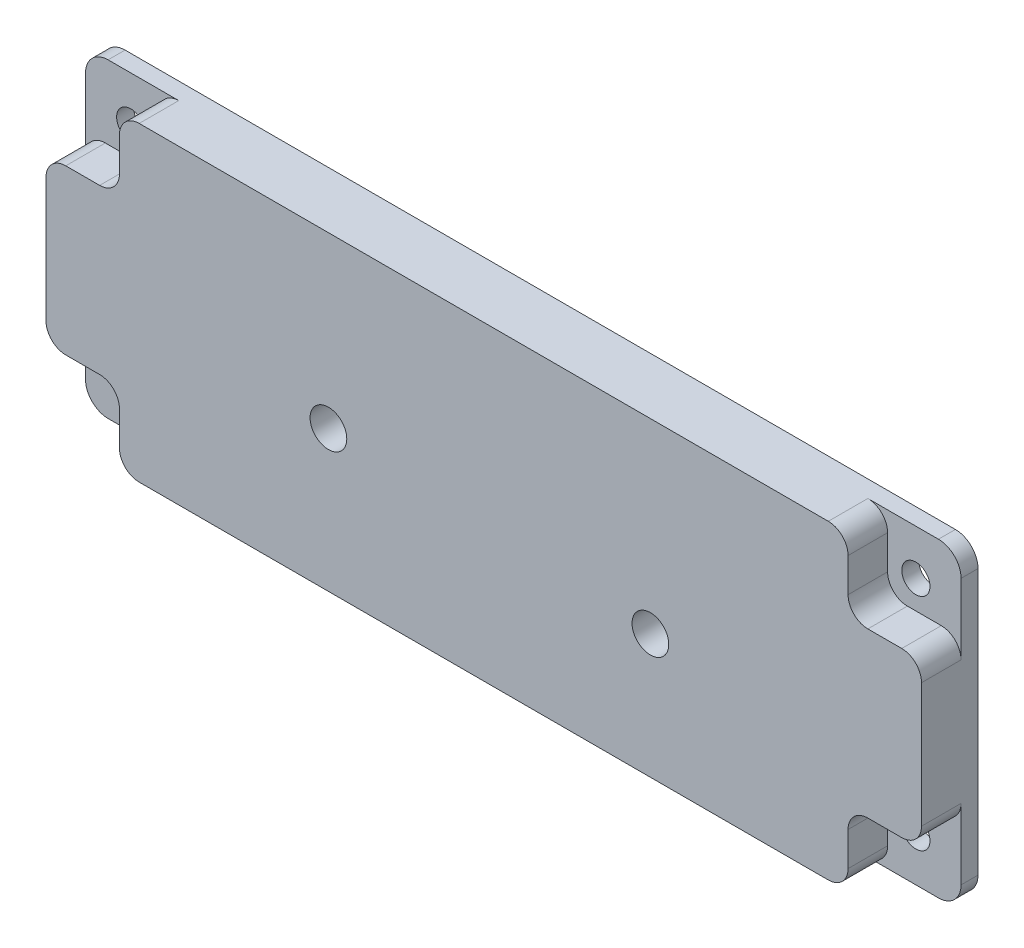
from build123d import *

# Parameters (mm, degrees)
SKETCH1_R           = 3.25
BOSS_EXTRUDE1_DEPTH = 10
CUT_EXTRUDE1_DEPTH  = 7
SKETCH3_R           = 2.5
CUT_EXTRUDE2_DEPTH  = 10
FILLET1_R           = 3.5


with BuildPart() as part:
    # Sketch1 → Boss-Extrude1 (new body)
    with BuildSketch(Plane.XY):
        with BuildLine():
            Line((-73.747603834, 33.92172524), (73.252396166, 33.92172524))
            ThreePointArc((73.252396166, 33.92172524), (76.080823291, 32.750152364), (77.252396166, 29.92172524))
            Line((77.252396166, 29.92172524), (77.252396166, -17.07827476))
            ThreePointArc((77.252396166, -17.07827476), (76.080823291, -19.906701885), (73.252396166, -21.07827476))
            Line((73.252396166, -21.07827476), (-73.747603834, -21.07827476))
            ThreePointArc((-73.747603834, -21.07827476), (-76.576030959, -19.906701885), (-77.747603834, -17.07827476))
            Line((-77.747603834, -17.07827476), (-77.747603834, 29.92172524))
            ThreePointArc((-77.747603834, 29.92172524), (-76.576030959, 32.750152364), (-73.747603834, 33.92172524))
        make_face()
        with Locations((-27.747603834, 3.92172524)):
            Circle(SKETCH1_R, mode=Mode.SUBTRACT)
        with Locations((29.252396166, 0.92172524)):
            Circle(SKETCH1_R, mode=Mode.SUBTRACT)
    extrude(amount=BOSS_EXTRUDE1_DEPTH)

    # Sketch2 → Cut-Extrude1 (cut)
    with BuildSketch(Plane.XY.offset(10)):
        with BuildLine():
            Line((-77.747603834, 20.92172524), (-68.247603834, 20.92172524))
            ThreePointArc((-68.247603834, 20.92172524), (-65.7727301, 21.946851505), (-64.747603834, 24.42172524))
            Line((-64.747603834, 24.42172524), (-64.747603834, 33.92172524))
            Line((-64.747603834, 33.92172524), (-77.747603834, 33.92172524))
            Line((-77.747603834, 33.92172524), (-77.747603834, 20.92172524))
        make_face()
        with BuildLine():
            Line((-77.747603834, -8.07827476), (-68.247603834, -8.07827476))
            ThreePointArc((-68.247603834, -8.07827476), (-65.7727301, -9.103401026), (-64.747603834, -11.57827476))
            Line((-64.747603834, -11.57827476), (-64.747603834, -21.07827476))
            Line((-64.747603834, -21.07827476), (-77.747603834, -21.07827476))
            Line((-77.747603834, -21.07827476), (-77.747603834, -8.07827476))
        make_face()
        with BuildLine():
            Line((64.252396166, -21.07827476), (77.252396166, -21.07827476))
            Line((77.252396166, -21.07827476), (77.252396166, -8.07827476))
            Line((77.252396166, -8.07827476), (67.752396166, -8.07827476))
            ThreePointArc((67.752396166, -8.07827476), (65.277522432, -9.103401026), (64.252396166, -11.57827476))
            Line((64.252396166, -11.57827476), (64.252396166, -21.07827476))
        make_face()
        with BuildLine():
            Line((77.252396166, 20.92172524), (67.752396166, 20.92172524))
            ThreePointArc((67.752396166, 20.92172524), (65.277522432, 21.946851505), (64.252396166, 24.42172524))
            Line((64.252396166, 24.42172524), (64.252396166, 33.92172524))
            Line((64.252396166, 33.92172524), (77.252396166, 33.92172524))
            Line((77.252396166, 33.92172524), (77.252396166, 20.92172524))
        make_face()
    extrude(amount=-CUT_EXTRUDE1_DEPTH, mode=Mode.SUBTRACT)

    # Sketch3 → Cut-Extrude2 (cut)
    with BuildSketch(Plane.XY.offset(3)):
        with Locations((-69.747603834, 25.92172524)):
            Circle(SKETCH3_R)
        with Locations((69.252396166, 25.92172524)):
            Circle(SKETCH3_R)
        with Locations((69.252396166, -13.07827476)):
            Circle(SKETCH3_R)
        with Locations((-69.747603834, -13.07827476)):
            Circle(SKETCH3_R)
    extrude(amount=-CUT_EXTRUDE2_DEPTH, mode=Mode.SUBTRACT)

    # Fillet1
    fillet1_edges = [part.edges().sort_by_distance(p)[0] for p in [
        (64.252396166, 33.92172524, 6.5),
        (77.252396166, 20.92172524, 6.5),
        (77.252396166, -8.07827476, 6.5),
        (64.252396166, -21.07827476, 6.5),
        (-64.747603834, -21.07827476, 6.5),
        (-77.747603834, -8.07827476, 6.5),
        (-77.747603834, 20.92172524, 6.5),
        (-64.747603834, 33.92172524, 6.5),
    ]]
    fillet(fillet1_edges, radius=FILLET1_R)


solid = part.part
